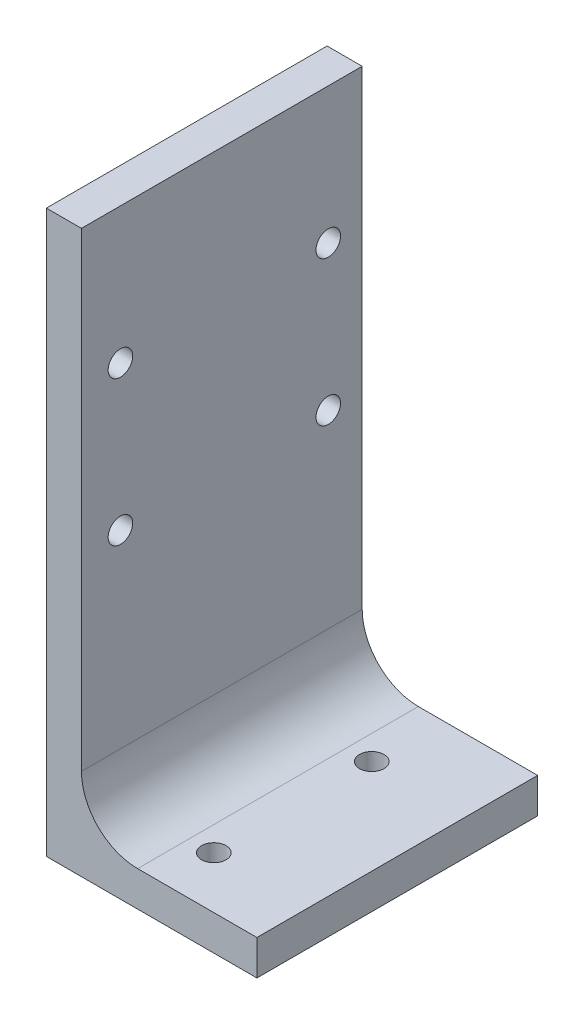
from build123d import *

# Parameters (mm, degrees)
RESSALTO_EXTRUS_O1_DEPTH                   = 40
BROCA_DE_ROSQUEAR_PARA_HELICOIDE_M31_D     = 3.5
BROCA_DE_ROSQUEAR_PARA_HELICOIDE_M31_DEPTH = 10
BROCA_DE_ROSQUEAR_PARA_HELICOIDE_M31_TIP   = 1.051506083
BROCA_DE_ROSQUEAR_PARA_HELICOIDE_M32_D     = 3.5
BROCA_DE_ROSQUEAR_PARA_HELICOIDE_M32_DEPTH = 10
BROCA_DE_ROSQUEAR_PARA_HELICOIDE_M32_TIP   = 1.051506083
FILETE1_R                                  = 8


with BuildPart() as part:
    # Esboço1 → Ressalto-extrusão1 (new body)
    with BuildSketch(Plane.XY):
        Polygon((-30, 40.02617801), (-30, -39.97382199), (0, -39.97382199), (0, -34.97382199), (-25, -34.97382199), (-25, 40.02617801), align=None)
    extrude(amount=RESSALTO_EXTRUS_O1_DEPTH)

    # Broca de rosquear para helicoide M31
    with Locations(Plane(origin=(0, -34.97382199, 0), x_dir=(1, 0, 0), z_dir=(0, 1, 0))):
        with Locations((-13.529029312, -32.612904954), (-13.529029312, -10.11076891)):
            Hole(BROCA_DE_ROSQUEAR_PARA_HELICOIDE_M31_D / 2, depth=BROCA_DE_ROSQUEAR_PARA_HELICOIDE_M31_DEPTH)
            with Locations((0, 0, -(BROCA_DE_ROSQUEAR_PARA_HELICOIDE_M31_DEPTH + BROCA_DE_ROSQUEAR_PARA_HELICOIDE_M31_TIP / 2))):  # 118° drill point
                Cone(0, BROCA_DE_ROSQUEAR_PARA_HELICOIDE_M31_D / 2, BROCA_DE_ROSQUEAR_PARA_HELICOIDE_M31_TIP, mode=Mode.SUBTRACT)

    # Broca de rosquear para helicoide M32
    with Locations(Plane.ZY.offset(30)):
        with Locations((4.832044367, 20.635096837), (34.443923193, 20.635096837), (34.443923193, 0), (4.832044367, 0)):
            Hole(BROCA_DE_ROSQUEAR_PARA_HELICOIDE_M32_D / 2, depth=BROCA_DE_ROSQUEAR_PARA_HELICOIDE_M32_DEPTH)
            with Locations((0, 0, -(BROCA_DE_ROSQUEAR_PARA_HELICOIDE_M32_DEPTH + BROCA_DE_ROSQUEAR_PARA_HELICOIDE_M32_TIP / 2))):  # 118° drill point
                Cone(0, BROCA_DE_ROSQUEAR_PARA_HELICOIDE_M32_D / 2, BROCA_DE_ROSQUEAR_PARA_HELICOIDE_M32_TIP, mode=Mode.SUBTRACT)

    # Filete1
    filete1_edges = [part.edges().sort_by_distance(p)[0] for p in [
        (-25, -34.97382199, 20),
    ]]
    fillet(filete1_edges, radius=FILETE1_R)


solid = part.part
